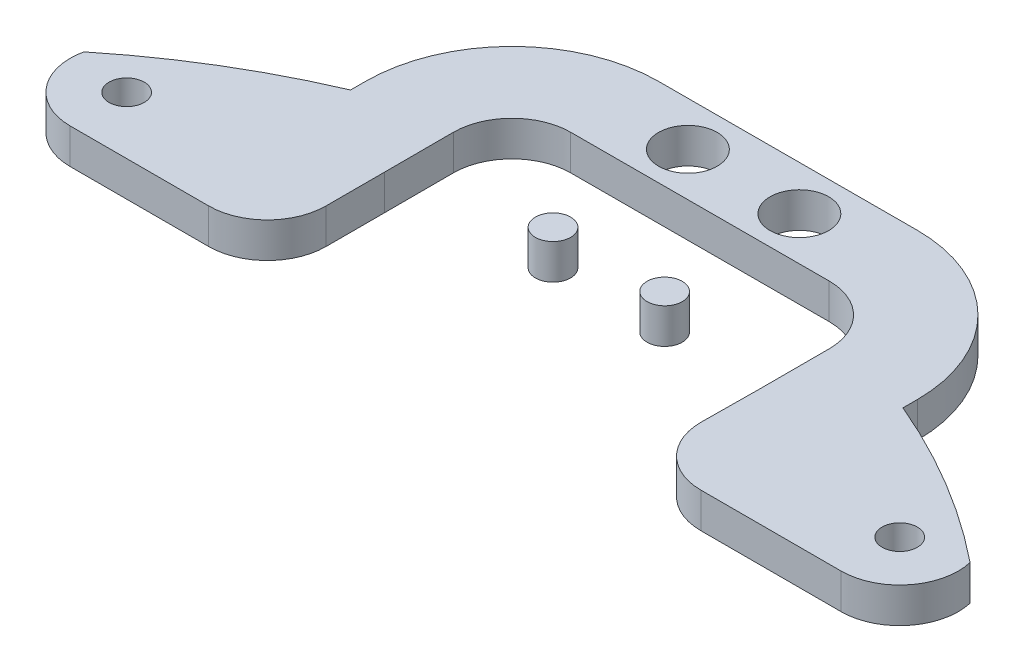
from build123d import *

# Parameters (mm, degrees)
CROQUIS1_R                = 1.5
SALIENTE_EXTRUIR1_DEPTH   = 3
SALIENTE_EXTRUIR1_2_DEPTH = 3
CROQUIS1_R_2              = 2.5
SALIENTE_EXTRUIR1_3_DEPTH = 3


with BuildPart() as part:
    # Croquis1 → Saliente-Extruir1 (new body)
    with BuildSketch(Plane(origin=(0, 0, 0), x_dir=(1, 0, 0), z_dir=(0, 1, 0))):
        with Locations(Location((56.748254661, 8.101959086, 0), (0, 0, 270))):
            Circle(CROQUIS1_R)
    extrude(amount=SALIENTE_EXTRUIR1_DEPTH)


with BuildPart() as body_2:
    # Croquis1 → Saliente-Extruir1 2 (new body)
    with BuildSketch(Plane(origin=(0, 0, 0), x_dir=(1, 0, 0), z_dir=(0, 1, 0))):
        with Locations(Location((66.248241595, 8.117715552, 0), (0, 0, 270))):
            Circle(CROQUIS1_R)
    extrude(amount=SALIENTE_EXTRUIR1_2_DEPTH)


with BuildPart() as body_3:
    # Croquis1 → Saliente-Extruir1 3 (new body)
    with BuildSketch(Plane(origin=(0, 0, 0), x_dir=(1, 0, 0), z_dir=(0, 1, 0))):
        with BuildLine():
            Line((77.495135153, 5), (77.449947836, 0.045601335))
            ThreePointArc((77.449947836, 0.045601335), (78.898120064, -3.51937447), (82.449739883, -5))
            Line((82.449739883, -5), (94.40174416, -5))
            ThreePointArc((94.40174416, -5), (98.31410499, -3.113427811), (99.274085367, 1.122626905))
            ThreePointArc((99.274085367, 1.122626905), (92.432310502, 5.899717334), (84.993937094, 9.681393854))
            Line((84.993937094, 9.681393854), (84.993616976, 10.921568689))
            ThreePointArc((84.993616976, 10.921568689), (81.317796903, 19.754318979), (72.472901978, 23.400819305))
            Line((72.472901978, 23.400819305), (50.472932237, 23.364330648))
            ThreePointArc((50.472932237, 23.364330648), (41.640181948, 19.688510575), (37.993681622, 10.84361565))
            Line((37.993681622, 10.84361565), (37.993978927, 9.601951381))
            ThreePointArc((37.993978927, 9.601951381), (30.607541127, 5.818750528), (23.813780611, 1.052526644))
            ThreePointArc((23.813780611, 1.052526644), (24.811844855, -3.141446067), (28.70174416, -5))
            Line((28.70174416, -5), (40.503384027, -5))
            ThreePointArc((40.503384027, -5), (44.038917933, -3.535533906), (45.503384027, 0))
            Line((45.503384027, 0), (45.503384027, 5))
            Line((45.503384027, 5), (45.493671306, 10.856054964))
            ThreePointArc((45.493671306, 10.856054964), (46.952271436, 14.394012935), (50.485371552, 15.864340964))
            Line((50.485371552, 15.864340964), (72.485341292, 15.900829621))
            ThreePointArc((72.485341292, 15.900829621), (76.023299263, 14.44222949), (77.493627292, 10.909129374))
            Line((77.493627292, 10.909129374), (77.495135153, 5))
        make_face()
        with Locations(Location((56.748254661, 19.599780569, 0), (0, 0, 270))):
            Circle(CROQUIS1_R_2, mode=Mode.SUBTRACT)
        with Locations(Location((66.248241595, 19.599780569, 0), (0, 0, 270))):
            Circle(CROQUIS1_R_2, mode=Mode.SUBTRACT)
        with Locations(Location((28.619794204, -0.109104468, 0), (0, 0, 270))):
            Circle(CROQUIS1_R, mode=Mode.SUBTRACT)
        with Locations(Location((94.401744161, 0, 0), (0, 0, 270))):
            Circle(CROQUIS1_R, mode=Mode.SUBTRACT)
    extrude(amount=SALIENTE_EXTRUIR1_3_DEPTH)


solid = Compound([part.part, body_2.part, body_3.part])
